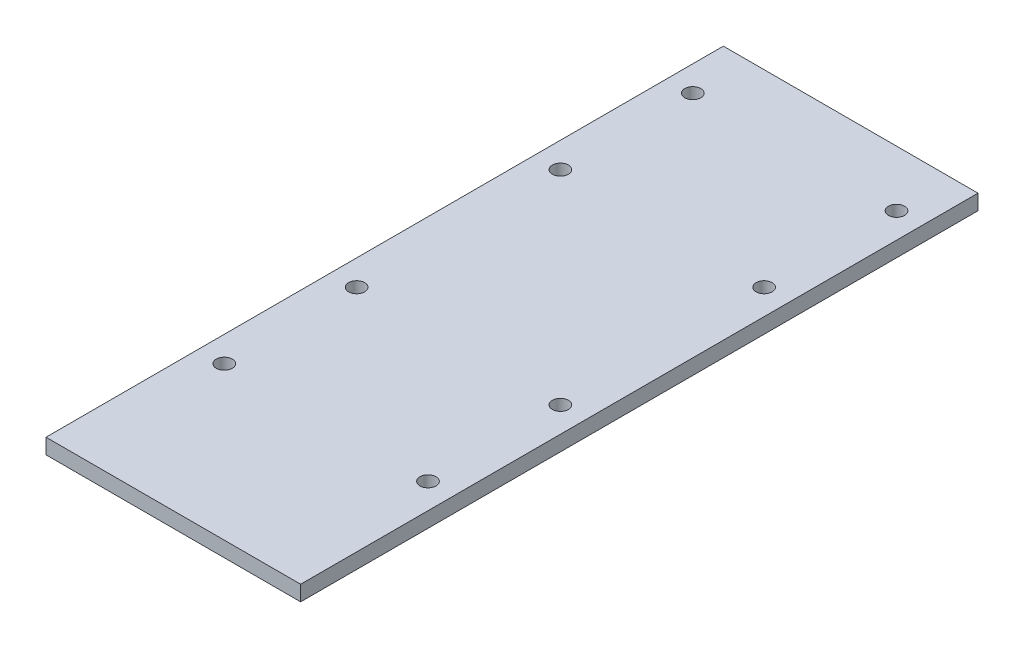
from build123d import *

# Parameters (mm, degrees)
SKETCH_1_W      = 50
SKETCH_1_H      = 133
SKETCH_1_R      = 1.575
EXTRUDE_1_DEPTH = 3


with BuildPart() as part:
    # 草图1 → 凸台-拉伸1 (new body)
    with BuildSketch(Plane(origin=(0, 0, 0), x_dir=(1, 0, 0), z_dir=(0, 1, 0))):
        Rectangle(SKETCH_1_W, SKETCH_1_H)
        with Locations(Location((-20, -36.5, 0), (0, 0, 270))):
            Circle(SKETCH_1_R, mode=Mode.SUBTRACT)
        with Locations(Location((-20, -10.5, 0), (0, 0, 270))):
            Circle(SKETCH_1_R, mode=Mode.SUBTRACT)
        with Locations(Location((20, -36.5, 0), (0, 0, 270))):
            Circle(SKETCH_1_R, mode=Mode.SUBTRACT)
        with Locations(Location((20, -10.5, 0), (0, 0, 270))):
            Circle(SKETCH_1_R, mode=Mode.SUBTRACT)
        with Locations(Location((20, 29.5, 0), (0, 0, 270))):
            Circle(SKETCH_1_R, mode=Mode.SUBTRACT)
        with Locations(Location((-20, 29.5, 0), (0, 0, 270))):
            Circle(SKETCH_1_R, mode=Mode.SUBTRACT)
        with Locations(Location((-20, 55.5, 0), (0, 0, 270))):
            Circle(SKETCH_1_R, mode=Mode.SUBTRACT)
        with Locations(Location((20, 55.5, 0), (0, 0, 270))):
            Circle(SKETCH_1_R, mode=Mode.SUBTRACT)
    extrude(amount=EXTRUDE_1_DEPTH)


solid = part.part
